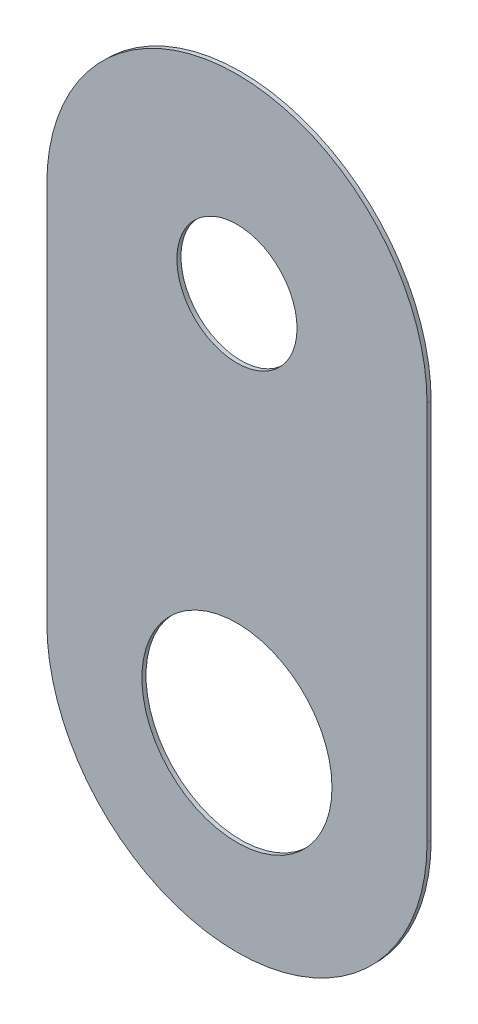
from build123d import *

# Parameters (mm, degrees)
BOSS_EXTRUDE1_DEPTH = 0.549916313
SKETCH2_R           = 12.7
SKETCH2_R_2         = 8.0264
CUT_EXTRUDE2_DEPTH  = 92.582653423


with BuildPart() as part:
    # Sketch1 → Boss-Extrude1 (new body)
    with BuildSketch(Plane.XY):
        with BuildLine():
            Line((0, 0), (0, 50.8))
            ThreePointArc((0, 50.8), (25.4, 76.2), (50.8, 50.8))
            Line((50.8, 50.8), (50.8, 0))
            ThreePointArc((50.8, 0), (25.4, -25.4), (0, 0))
        make_face()
    extrude(amount=BOSS_EXTRUDE1_DEPTH)

    # Sketch2 → Cut-Extrude2 (cut, through all)
    with BuildSketch(Plane.XY.offset(0.549916313)):
        with Locations((25.4, 0)):
            Circle(SKETCH2_R)
        with Locations((25.4, 50.8)):
            Circle(SKETCH2_R_2)
    extrude(amount=-CUT_EXTRUDE2_DEPTH, mode=Mode.SUBTRACT)


solid = part.part
